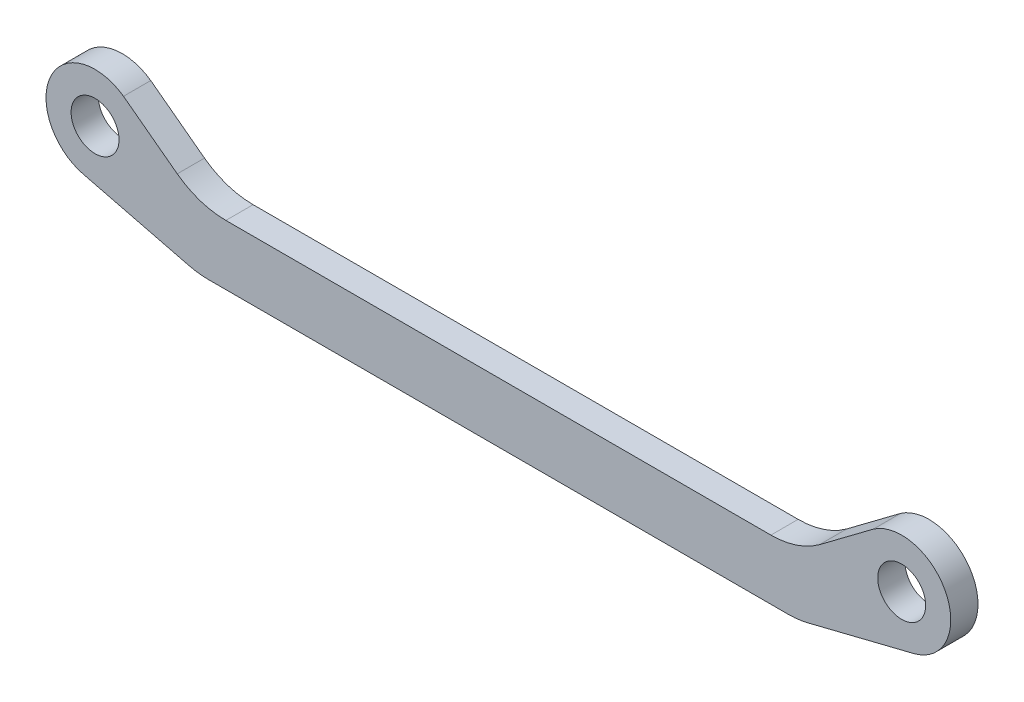
from build123d import *

# Parameters (mm, degrees)
ESQUISSE1_R        = 4.400000007
ESQUISSE1_R_2      = 4.4
BOSS_EXTRU_1_DEPTH = 5


with BuildPart() as part:
    # Esquisse1 → Boss.-Extru.1 (new body)
    with BuildSketch(Plane.XY):
        with BuildLine():
            Line((-75.591933606, -6.096726144), (-56.398924436, -10.872808857))
            ThreePointArc((-56.398924436, -10.872808857), (-54.601370742, -11.20533148), (-52.776716713, -11.316723833))
            Line((-52.776716713, -11.316723833), (53.548375844, -11.316723833))
            ThreePointArc((53.548375844, -11.316723833), (55.373029873, -11.20533148), (57.170583568, -10.872808857))
            Line((57.170583568, -10.872808857), (76.363586255, -6.096726144))
            ThreePointArc((76.363586255, -6.096726144), (82.603384887, 6.353670315), (69.166960675, 10.015631995))
            Line((69.166960675, 10.015631995), (59.305630369, 2.623543573))
            ThreePointArc((59.305630369, 2.623543573), (55.081785898, 0.437294771), (50.385829925, -0.316723427))
            Line((50.385829925, -0.316723427), (-49.61417004, -0.316723427))
            ThreePointArc((-49.61417004, -0.316723427), (-54.310126013, 0.437294771), (-58.533970484, 2.623543573))
            Line((-58.533970484, 2.623543573), (-68.395303593, 10.015631995))
            ThreePointArc((-68.395303593, 10.015631995), (-81.831724911, 6.353670739), (-75.591933606, -6.096726144))
        make_face()
        with Locations((-73.614170035, 2.683276775)):
            Circle(ESQUISSE1_R, mode=Mode.SUBTRACT)
        with Locations((74.385829169, 2.683278236)):
            Circle(ESQUISSE1_R_2, mode=Mode.SUBTRACT)
    extrude(amount=BOSS_EXTRU_1_DEPTH)


solid = part.part
